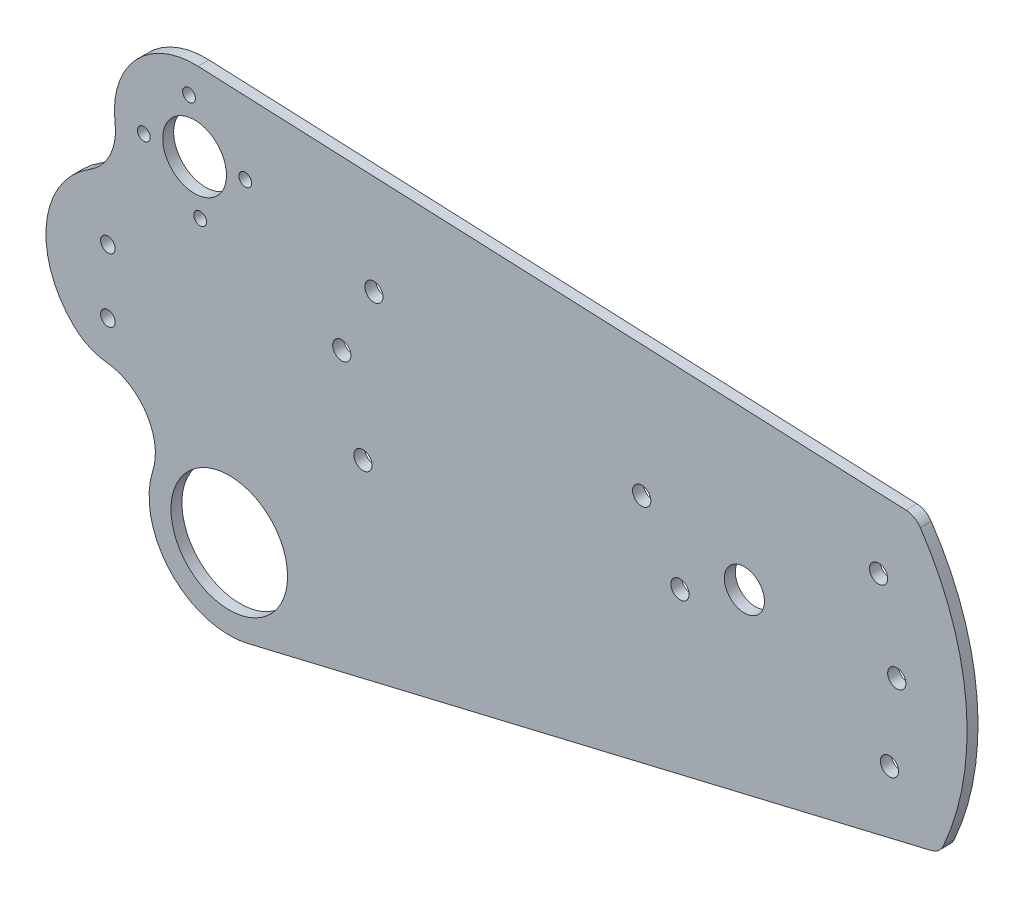
from build123d import *

# Parameters (mm, degrees)
SKETCH1_R           = 2
SKETCH1_R_2         = 2.5
SKETCH1_R_3         = 5.5
SKETCH1_R_4         = 1.75
SKETCH1_R_5         = 8.75
SKETCH1_R_6         = 16
BOSS_EXTRUDE1_DEPTH = 3


with BuildPart() as part:
    # Sketch1 → Boss-Extrude1 (new body)
    with BuildSketch(Plane.XY):
        with BuildLine():
            ThreePointArc((-113.560266524, 49.479735972), (-130.694234864, 42.395842918), (-136.329525131, 24.732380193))
            ThreePointArc((-136.329525131, 24.732380193), (-137.686520221, 16.356467092), (-143.370984404, 10.056925608))
            ThreePointArc((-143.370984404, 10.056925608), (-155.166532009, -8.626129333), (-147.542861296, -29.364285714))
            ThreePointArc((-147.542861296, -29.364285714), (-143.475887893, -32.124161339), (-138.735140925, -33.421275181))
            ThreePointArc((-138.735140925, -33.421275181), (-127.733357788, -40.106373668), (-125.965715234, -52.858048609))
            ThreePointArc((-125.965715234, -52.858048609), (-121.095745837, -74.463536483), (-99.899442158, -80.884628179))
            Line((-99.899442158, -80.884628179), (87.590338172, -36.326384859))
            ThreePointArc((87.590338172, -36.326384859), (89.625170423, -35.311295666), (91, -33.5))
            ThreePointArc((91, -33.5), (97.213976906, 3.543991621), (84.648444567, 38.941424032))
            ThreePointArc((84.648444567, 38.941424032), (82.945648013, 40.504860181), (80.721588123, 41.135261877))
            Line((80.721588123, 41.135261877), (-113.560266524, 49.479735972))
        make_face()
        with Locations((-138.3, -22.75)):
            Circle(SKETCH1_R, mode=Mode.SUBTRACT)
        with Locations((-68.3, -21.5)):
            Circle(SKETCH1_R_2, mode=Mode.SUBTRACT)
        with Locations((-138.3, -5.25)):
            Circle(SKETCH1_R, mode=Mode.SUBTRACT)
        with Locations((-74.1, 1.7)):
            Circle(SKETCH1_R_2, mode=Mode.SUBTRACT)
        with Locations((18.7, -8.7)):
            Circle(SKETCH1_R_2, mode=Mode.SUBTRACT)
        with Locations((76.2, -22)):
            Circle(SKETCH1_R_2, mode=Mode.SUBTRACT)
        with Locations((8.2, 8.3)):
            Circle(SKETCH1_R_2, mode=Mode.SUBTRACT)
        with Locations((36.382449965, 0)):
            Circle(SKETCH1_R_3, mode=Mode.SUBTRACT)
        with Locations((78.2, -0.1)):
            Circle(SKETCH1_R_2, mode=Mode.SUBTRACT)
        with Locations((-112.981409671, 13.583075301)):
            Circle(SKETCH1_R_4, mode=Mode.SUBTRACT)
        with Locations((-128.421228626, 25.977105744)):
            Circle(SKETCH1_R_4, mode=Mode.SUBTRACT)
        with Locations((-65.3, 20)):
            Circle(SKETCH1_R_2, mode=Mode.SUBTRACT)
        with Locations((-114.504303927, 27.5)):
            Circle(SKETCH1_R_5, mode=Mode.SUBTRACT)
        with Locations((-100.587379227, 29.022894256)):
            Circle(SKETCH1_R_4, mode=Mode.SUBTRACT)
        with Locations((-116.027198182, 41.416924699)):
            Circle(SKETCH1_R_4, mode=Mode.SUBTRACT)
        with Locations((73.2, 22.3)):
            Circle(SKETCH1_R_2, mode=Mode.SUBTRACT)
        with Locations((-104.986214828, -59.480779371)):
            Circle(SKETCH1_R_6, mode=Mode.SUBTRACT)
    extrude(amount=BOSS_EXTRUDE1_DEPTH)


solid = part.part
